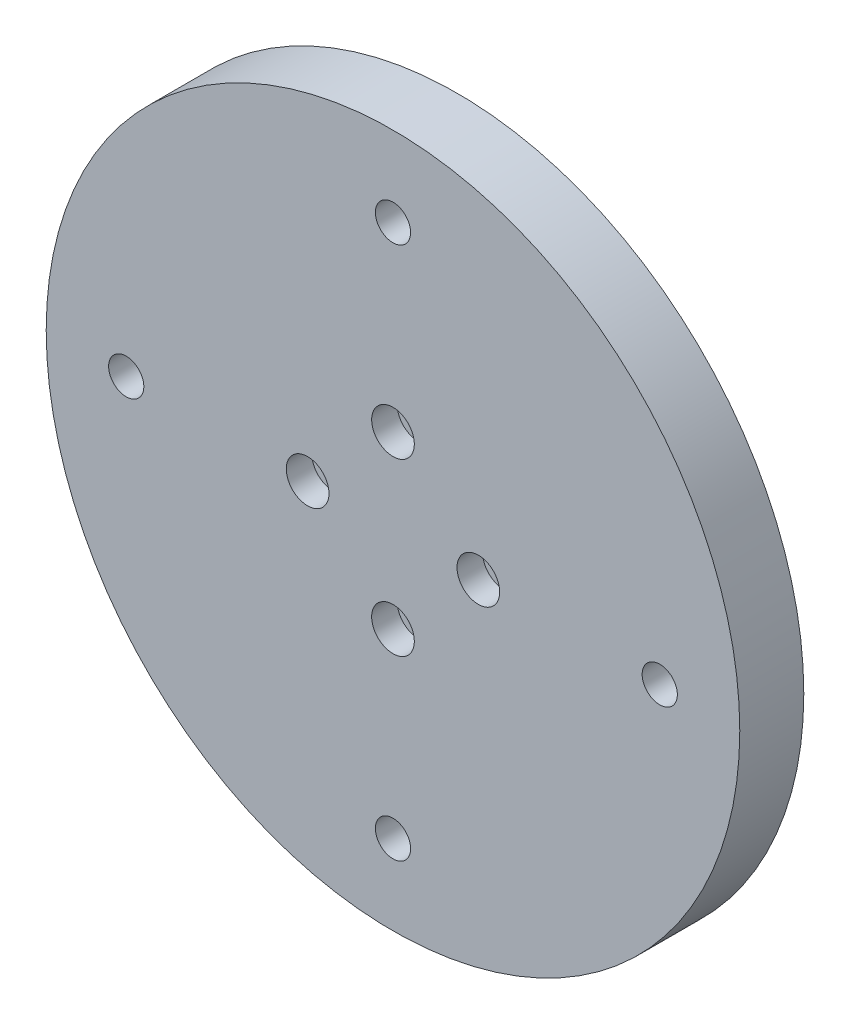
from build123d import *

# Parameters (mm, degrees)
SKETCH1_R           = 32.5
BOSS_EXTRUDE1_DEPTH = 6
SKETCH16_R          = 1.1
CUT_EXTRUDE8_DEPTH  = 47.351914739
SKETCH17_R          = 2
CUT_EXTRUDE9_DEPTH  = 2.4
SKETCH12_R          = 1.65
CUT_EXTRUDE10_DEPTH = 47.351914739


with BuildPart() as part:
    # Sketch1 → Boss-Extrude1 (new body)
    with BuildSketch(Plane.XY):
        Circle(SKETCH1_R)
    extrude(amount=BOSS_EXTRUDE1_DEPTH)

    # Sketch16 → Cut-Extrude8 (cut, through all)
    with BuildSketch(Plane.XY.offset(6)):
        with Locations((8, 0)):
            Circle(SKETCH16_R)
        with Locations((-8, 0)):
            Circle(SKETCH16_R)
        with Locations((0, -8)):
            Circle(SKETCH16_R)
        with Locations((0, 8)):
            Circle(SKETCH16_R)
    extrude(amount=-CUT_EXTRUDE8_DEPTH, mode=Mode.SUBTRACT)

    # Sketch17 → Cut-Extrude9 (cut)
    with BuildSketch(Plane.XY.offset(6)):
        with Locations((8, 0)):
            Circle(SKETCH17_R)
        with Locations((-8, 0)):
            Circle(SKETCH17_R)
        with Locations((0, -8)):
            Circle(SKETCH17_R)
        with Locations((0, 8)):
            Circle(SKETCH17_R)
    extrude(amount=-CUT_EXTRUDE9_DEPTH, mode=Mode.SUBTRACT)

    # Sketch12 → Cut-Extrude10 (cut, through all)
    with BuildSketch(Plane.XY.offset(6)):
        with Locations((0, 25)):
            Circle(SKETCH12_R)
        with Locations((25, 0)):
            Circle(SKETCH12_R)
        with Locations((0, -25)):
            Circle(SKETCH12_R)
        with Locations((-25, 0)):
            Circle(SKETCH12_R)
    extrude(amount=-CUT_EXTRUDE10_DEPTH, mode=Mode.SUBTRACT)


solid = part.part
